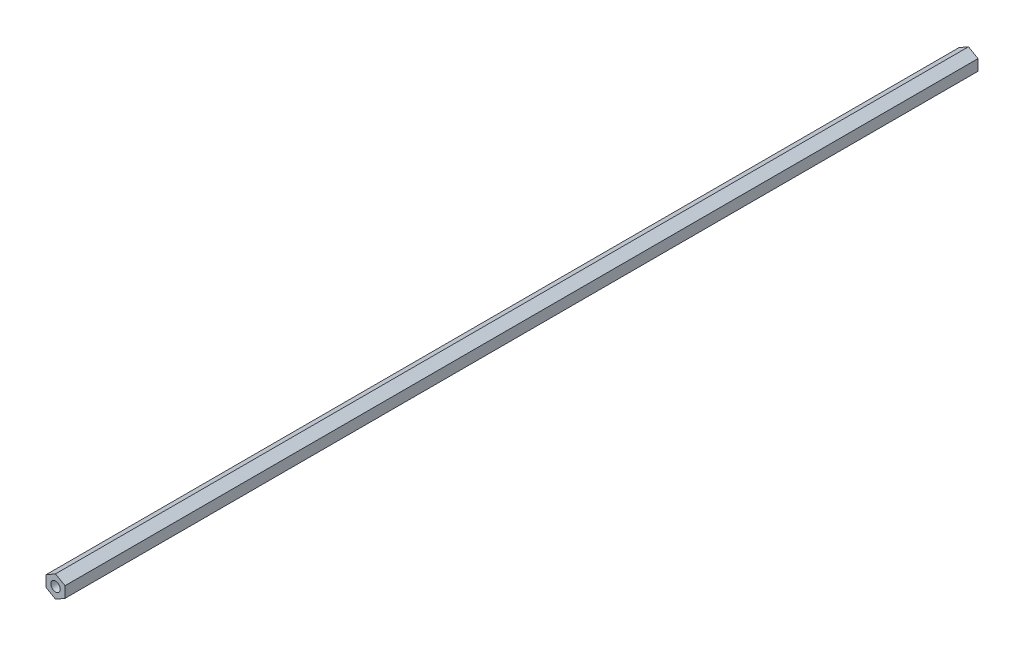
from build123d import *

# Parameters (mm, degrees)
BOSS_EXTRUDE2_DEPTH             = 304.8
BOSS_EXTRUDE2_DEPTH_BACK        = 304.8
F_1_4_0_25_DIAMETER_HOLE1_D     = 6.35
F_1_4_0_25_DIAMETER_HOLE1_DEPTH = 25.4
F_1_4_0_25_DIAMETER_HOLE1_TIP   = 1.907732465
F_1_4_0_25_DIAMETER_HOLE2_D     = 6.35
F_1_4_0_25_DIAMETER_HOLE2_DEPTH = 25.4
F_1_4_0_25_DIAMETER_HOLE2_TIP   = 1.907732465


with BuildPart() as part:
    # Sketch3 → Boss-Extrude2 (new, two sides: drawn at the far end of the back side and taken through both)
    with BuildSketch(Plane.XY.offset(-BOSS_EXTRUDE2_DEPTH_BACK)):
        Polygon((-6.35, -3.666174209), (0, -7.332348419), (6.35, -3.666174209), (6.35, 3.666174209), (0, 7.332348419), (-6.35, 3.666174209), align=None)
    extrude(amount=BOSS_EXTRUDE2_DEPTH + BOSS_EXTRUDE2_DEPTH_BACK)

    # 1/4 (0.25) Diameter Hole1
    with Locations(Plane.XY.offset(304.8)):
        with Locations((0, 0)):
            Hole(F_1_4_0_25_DIAMETER_HOLE1_D / 2, depth=F_1_4_0_25_DIAMETER_HOLE1_DEPTH)
            with Locations((0, 0, -(F_1_4_0_25_DIAMETER_HOLE1_DEPTH + F_1_4_0_25_DIAMETER_HOLE1_TIP / 2))):  # 118° drill point
                Cone(0, F_1_4_0_25_DIAMETER_HOLE1_D / 2, F_1_4_0_25_DIAMETER_HOLE1_TIP, mode=Mode.SUBTRACT)

    # 1/4 (0.25) Diameter Hole2
    with Locations(Plane(origin=(0, 0, -304.8), x_dir=(-1, 0, 0), z_dir=(0, 0, -1))):
        with Locations((0, 0)):
            Hole(F_1_4_0_25_DIAMETER_HOLE2_D / 2, depth=F_1_4_0_25_DIAMETER_HOLE2_DEPTH)
            with Locations((0, 0, -(F_1_4_0_25_DIAMETER_HOLE2_DEPTH + F_1_4_0_25_DIAMETER_HOLE2_TIP / 2))):  # 118° drill point
                Cone(0, F_1_4_0_25_DIAMETER_HOLE2_D / 2, F_1_4_0_25_DIAMETER_HOLE2_TIP, mode=Mode.SUBTRACT)


solid = part.part
